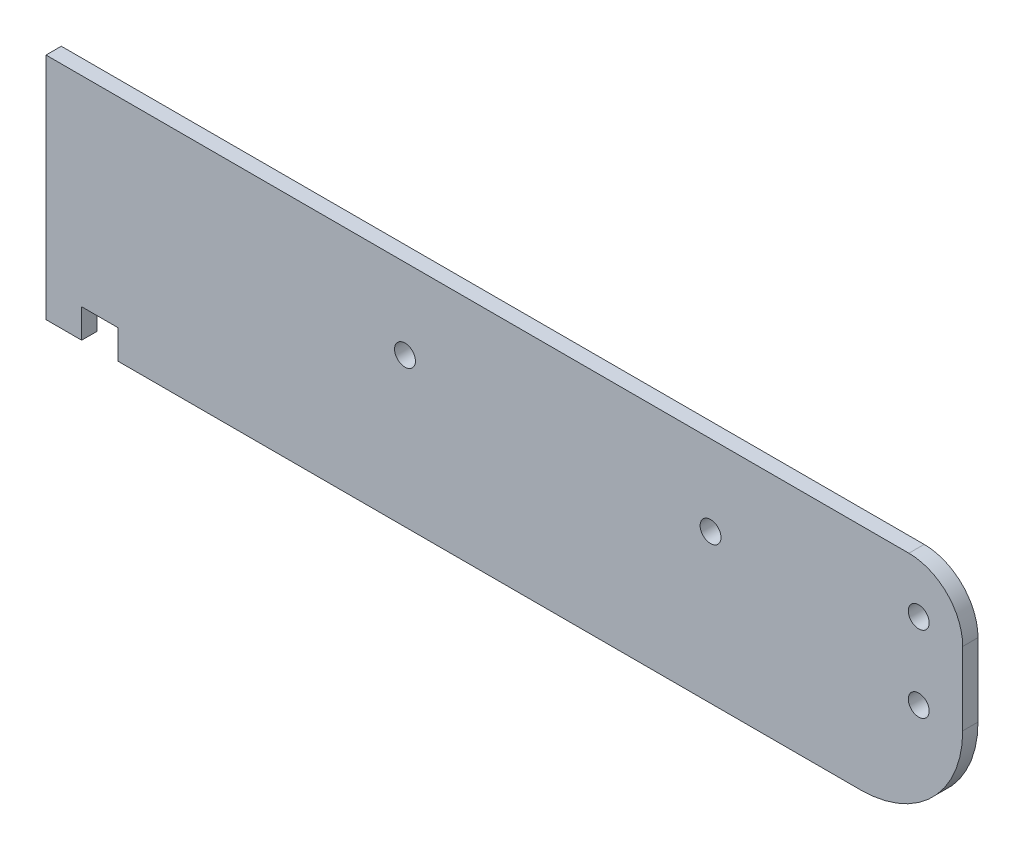
from build123d import *

# Parameters (mm, degrees)
EXTRUDE_1_DEPTH     = 3
SKETCH_2_W          = 7.1
SKETCH_2_H          = 5.7
CUT_EXTRUDE_1_DEPTH = 127.757680391
SKETCH_3_R          = 2.05
CUT_EXTRUDE_2_DEPTH = 127.757680391


with BuildPart() as part:
    # 스케치1 → 보스-돌출1 (new body)
    with BuildSketch(Plane.XY):
        with BuildLine():
            Line((77.962543428, 13.364192405), (-57.290239933, 13.364192405))
            Line((-57.290239933, 13.364192405), (-57.290239933, 1.630404544))
            Line((-57.290239933, 1.630404544), (-57.290239933, -6.697716143))
            Line((-57.290239933, -6.697716143), (-57.290239933, -31.635807595))
            Line((-57.290239933, -31.635807595), (102.63413291, -31.635807595))
            ThreePointArc((102.63413291, -31.635807595), (116.82974501, -25.755792538), (122.709760067, -11.560180438))
            Line((122.709760067, -11.560180438), (122.709760067, 2.792586849))
            ThreePointArc((122.709760067, 2.792586849), (119.613408488, 10.267840825), (112.138154512, 13.364192405))
            Line((112.138154512, 13.364192405), (77.962543428, 13.364192405))
        make_face()
    extrude(amount=EXTRUDE_1_DEPTH)

    # 스케치2 → 컷-돌출1 (cut, through all)
    with BuildSketch(Plane(origin=(0, 0, 0), x_dir=(-1, 0, 0), z_dir=(0, 0, -1))):
        with Locations((46.740239933, -28.785807595)):
            Rectangle(SKETCH_2_W, SKETCH_2_H)
    extrude(amount=-CUT_EXTRUDE_1_DEPTH, mode=Mode.SUBTRACT)

    # 스케치3 → 컷-돌출2 (cut, through all)
    with BuildSketch(Plane(origin=(0, 0, 0), x_dir=(-1, 0, 0), z_dir=(0, 0, -1))):
        with Locations((-114.073037193, 3.507033956)):
            Circle(SKETCH_3_R)
        with Locations((-73.198629194, -2.419409625)):
            Circle(SKETCH_3_R)
        with Locations((-114.073037193, -11.492966044)):
            Circle(SKETCH_3_R)
        with Locations((-13.198629194, -2.419409625)):
            Circle(SKETCH_3_R)
    extrude(amount=-CUT_EXTRUDE_2_DEPTH, mode=Mode.SUBTRACT)


solid = part.part
